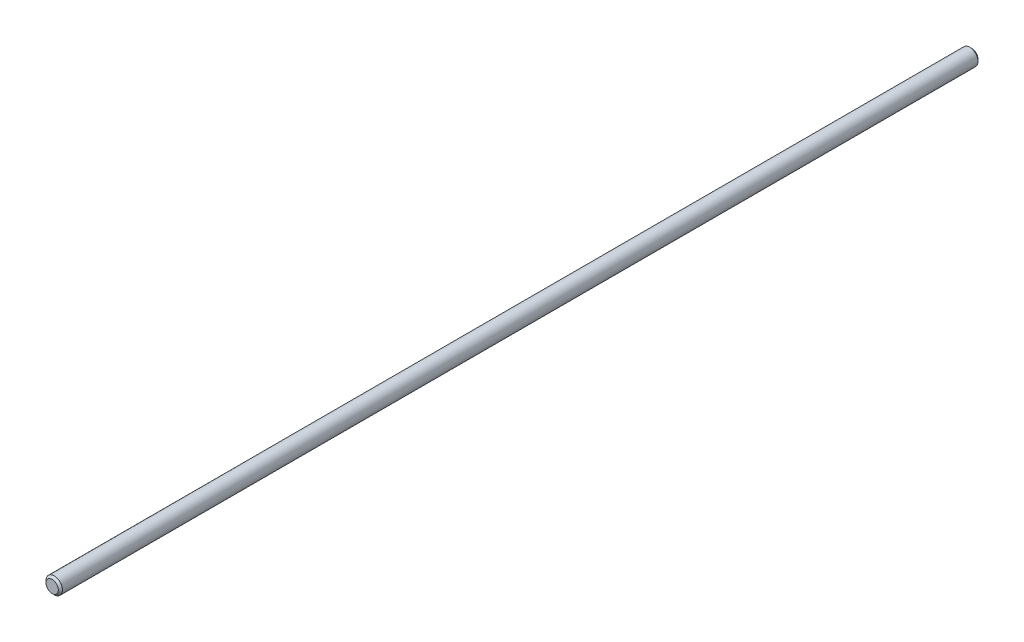
from build123d import *

# Parameters (mm, degrees)
SCHIZZO1_R                   = 4
ESTRUSIONE_ESTRUSIONE1_DEPTH = 448
SMUSSO1_SIZE                 = 1


with BuildPart() as part:
    # Schizzo1 → Estrusione-Estrusione1 (new body)
    with BuildSketch(Plane.XY):
        Circle(SCHIZZO1_R)
    extrude(amount=ESTRUSIONE_ESTRUSIONE1_DEPTH)

    # Smusso1
    smusso1_edges = [part.edges().sort_by_distance(p)[0] for p in [
        (-4, 0, 0),
        (-4, 0, 448),
    ]]
    chamfer(smusso1_edges, length=SMUSSO1_SIZE)


solid = part.part
